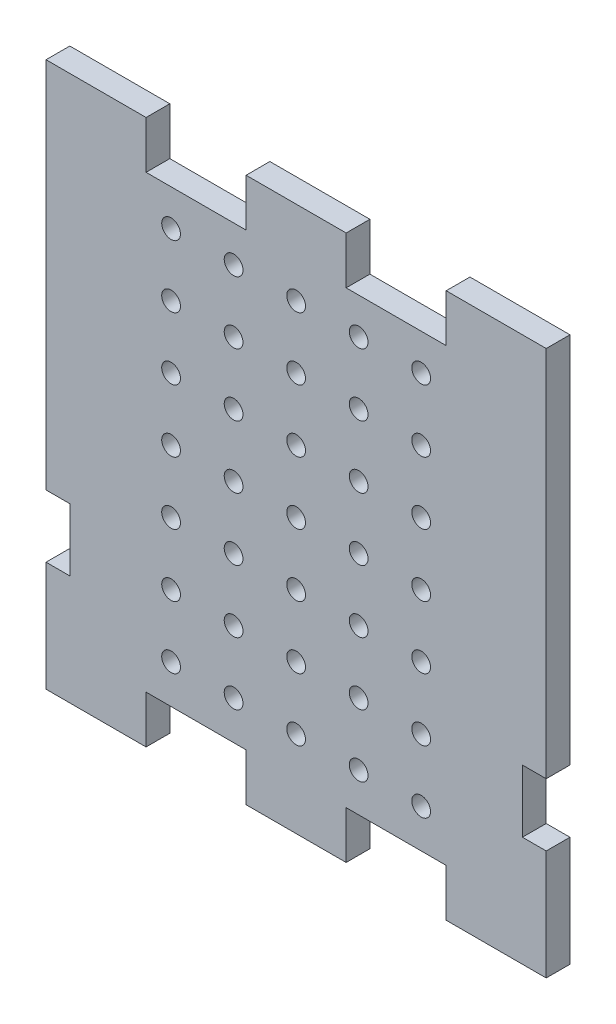
from build123d import *

# Parameters (mm, degrees)
BOSS_EXTRUDE1_DEPTH = 4.826
SKETCH2_R           = 1.905
CUT_EXTRUDE1_DEPTH  = 151.366498303
SKETCH3_W           = 4.826
SKETCH3_H           = 12.7
CUT_EXTRUDE2_DEPTH  = 151.366498303


with BuildPart() as part:
    # Sketch1 → Boss-Extrude1 (new body)
    with BuildSketch(Plane.XY):
        Polygon((0, 110.744), (0, 0), (20.32, 0), (20.32, 9.652), (40.64, 9.652), (40.64, 0), (60.96, 0), (60.96, 9.652), (81.28, 9.652), (81.28, 0), (101.6, 0), (101.6, 110.744), (81.28, 110.744), (81.28, 101.092), (60.96, 101.092), (60.96, 110.744), (40.64, 110.744), (40.64, 101.092), (20.32, 101.092), (20.32, 110.744), align=None)
    extrude(amount=BOSS_EXTRUDE1_DEPTH)

    # Sketch2 → Cut-Extrude1 (cut, through all)
    with BuildSketch(Plane.XY.offset(4.826)):
        with Locations((50.8, 68.326)):
            Circle(SKETCH2_R)
        with Locations((63.5, 68.326)):
            Circle(SKETCH2_R)
        with Locations((76.2, 68.326)):
            Circle(SKETCH2_R)
        with Locations((63.5, 81.026)):
            Circle(SKETCH2_R)
        with Locations((76.2, 81.026)):
            Circle(SKETCH2_R)
        with Locations((63.5, 93.726)):
            Circle(SKETCH2_R)
        with Locations((76.2, 93.726)):
            Circle(SKETCH2_R)
        with Locations((38.1, 68.326)):
            Circle(SKETCH2_R)
        with Locations((25.4, 68.326)):
            Circle(SKETCH2_R)
        with Locations((38.1, 81.026)):
            Circle(SKETCH2_R)
        with Locations((25.4, 81.026)):
            Circle(SKETCH2_R)
        with Locations((38.1, 93.726)):
            Circle(SKETCH2_R)
        with Locations((25.4, 93.726)):
            Circle(SKETCH2_R)
        with Locations((50.8, 81.026)):
            Circle(SKETCH2_R)
        with Locations((50.8, 93.726)):
            Circle(SKETCH2_R)
        with Locations((63.5, 55.626)):
            Circle(SKETCH2_R)
        with Locations((76.2, 55.626)):
            Circle(SKETCH2_R)
        with Locations((63.5, 42.926)):
            Circle(SKETCH2_R)
        with Locations((76.2, 42.926)):
            Circle(SKETCH2_R)
        with Locations((63.5, 30.226)):
            Circle(SKETCH2_R)
        with Locations((76.2, 30.226)):
            Circle(SKETCH2_R)
        with Locations((63.5, 17.526)):
            Circle(SKETCH2_R)
        with Locations((76.2, 17.526)):
            Circle(SKETCH2_R)
        with Locations((38.1, 55.626)):
            Circle(SKETCH2_R)
        with Locations((25.4, 55.626)):
            Circle(SKETCH2_R)
        with Locations((38.1, 42.926)):
            Circle(SKETCH2_R)
        with Locations((25.4, 42.926)):
            Circle(SKETCH2_R)
        with Locations((38.1, 30.226)):
            Circle(SKETCH2_R)
        with Locations((25.4, 30.226)):
            Circle(SKETCH2_R)
        with Locations((38.1, 17.526)):
            Circle(SKETCH2_R)
        with Locations((25.4, 17.526)):
            Circle(SKETCH2_R)
        with Locations((50.8, 55.626)):
            Circle(SKETCH2_R)
        with Locations((50.8, 42.926)):
            Circle(SKETCH2_R)
        with Locations((50.8, 30.226)):
            Circle(SKETCH2_R)
        with Locations((50.8, 17.526)):
            Circle(SKETCH2_R)
    extrude(amount=-CUT_EXTRUDE1_DEPTH, mode=Mode.SUBTRACT)

    # Sketch3 → Cut-Extrude2 (cut, through all)
    with BuildSketch(Plane.XY.offset(4.826)):
        with Locations((2.413, 28.702)):
            Rectangle(SKETCH3_W, SKETCH3_H)
        with Locations((99.187, 28.702)):
            Rectangle(SKETCH3_W, SKETCH3_H)
    extrude(amount=-CUT_EXTRUDE2_DEPTH, mode=Mode.SUBTRACT)


solid = part.part
